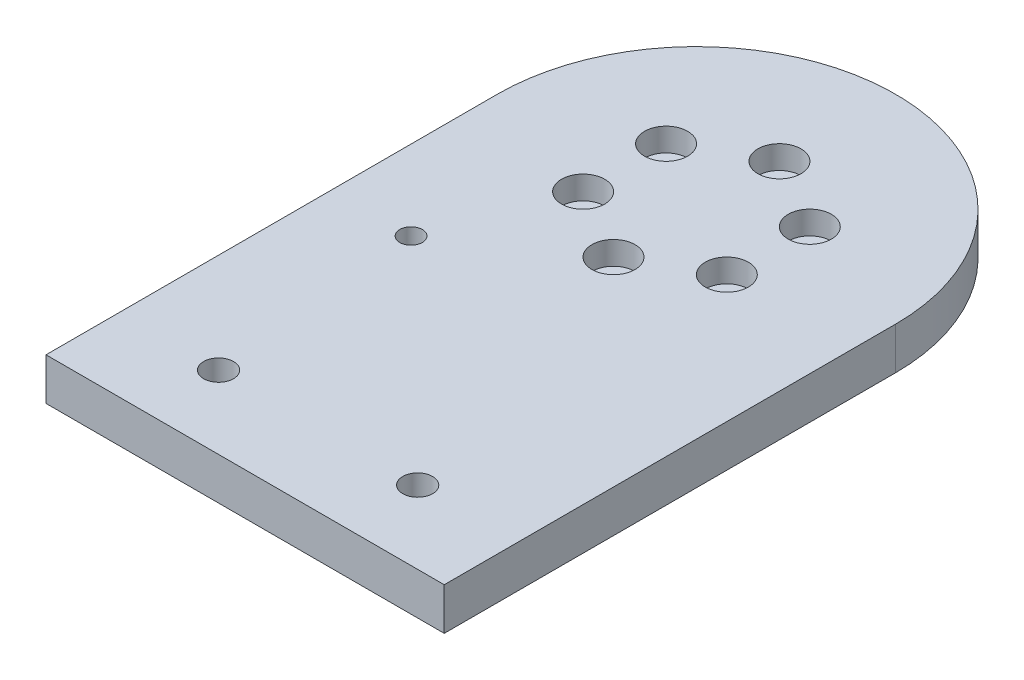
from build123d import *

# Parameters (mm, degrees)
PLACA_START               = 59.75
SK_PLACA_W                = 60
SK_PLACA_H                = 49
PLACA_DEPTH               = 6.35
EXTREMO_START             = 59.75
SK_EXTREMO_R              = 30
EXTREMO_DEPTH             = 6.35
PASANTES_M3_CUBO_J3_START = 59.75
SK_PASANTES_M3_CUBO_J3_R  = 1.7
PASANTES_M3_CUBO_J3_DEPTH = 6.35
CAJAS_M3_J3_START         = 62.6
SK_CAJAS_M3_J3_R          = 3.25
CAJAS_M3_J3_DEPTH         = 3.5
EXTENSION_PESTANAS_START  = 59.75
SK_EXTENSION_PESTANAS_W   = 60
SK_EXTENSION_PESTANAS_H   = 19
EXTENSION_PESTANAS_DEPTH  = 6.35
PASANTES_M4_REPISA_START  = 59.75
SK_PASANTES_M4_REPISA_R   = 2.25
PASANTES_M4_REPISA_DEPTH  = 6.35
PASANTE_M3_CINCHO_START   = 59.75
SK_PASANTE_M3_CINCHO_R    = 1.7
PASANTE_M3_CINCHO_DEPTH   = 6.35


with BuildPart() as part:
    # Sk_Placa → Placa (new body)
    with BuildSketch(Plane(origin=(0, 0, 0), x_dir=(1, 0, 0), z_dir=(0, 1, 0)).offset(PLACA_START)):
        with Locations((0, -354.5)):
            Rectangle(SK_PLACA_W, SK_PLACA_H)
    extrude(amount=PLACA_DEPTH)

    # Sk_Extremo → Extremo (add)
    with BuildSketch(Plane(origin=(0, 0, 0), x_dir=(1, 0, 0), z_dir=(0, 1, 0)).offset(EXTREMO_START)):
        with Locations((0, -330)):
            Circle(SK_EXTREMO_R)
    extrude(amount=EXTREMO_DEPTH)

    # Sk_Pasantes_M3_cubo_J3 → Pasantes_M3_cubo_J3 (cut)
    with BuildSketch(Plane(origin=(0, 0, 0), x_dir=(1, 0, 0), z_dir=(0, 1, 0)).offset(PASANTES_M3_CUBO_J3_START)):
        with Locations(Location((10.825317547, -336.25, 0), (0, 0, 270))):
            Circle(SK_PASANTES_M3_CUBO_J3_R)
        with Locations(Location((0, -342.5, 0), (0, 0, 270))):
            Circle(SK_PASANTES_M3_CUBO_J3_R)
        with Locations(Location((-10.825317547, -336.25, 0), (0, 0, 270))):
            Circle(SK_PASANTES_M3_CUBO_J3_R)
        with Locations(Location((-10.825317547, -323.75, 0), (0, 0, 270))):
            Circle(SK_PASANTES_M3_CUBO_J3_R)
        with Locations(Location((0, -317.5, 0), (0, 0, 270))):
            Circle(SK_PASANTES_M3_CUBO_J3_R)
        with Locations(Location((10.825317547, -323.75, 0), (0, 0, 270))):
            Circle(SK_PASANTES_M3_CUBO_J3_R)
    extrude(amount=PASANTES_M3_CUBO_J3_DEPTH, mode=Mode.SUBTRACT)

    # Sk_Cajas_M3_J3 → Cajas_M3_J3 (cut)
    with BuildSketch(Plane(origin=(0, 0, 0), x_dir=(1, 0, 0), z_dir=(0, 1, 0)).offset(CAJAS_M3_J3_START)):
        with Locations(Location((10.825317547, -336.25, 0), (0, 0, 270))):
            Circle(SK_CAJAS_M3_J3_R)
        with Locations(Location((0, -342.5, 0), (0, 0, 270))):
            Circle(SK_CAJAS_M3_J3_R)
        with Locations(Location((-10.825317547, -336.25, 0), (0, 0, 270))):
            Circle(SK_CAJAS_M3_J3_R)
        with Locations(Location((-10.825317547, -323.75, 0), (0, 0, 270))):
            Circle(SK_CAJAS_M3_J3_R)
        with Locations(Location((0, -317.5, 0), (0, 0, 270))):
            Circle(SK_CAJAS_M3_J3_R)
        with Locations(Location((10.825317547, -323.75, 0), (0, 0, 270))):
            Circle(SK_CAJAS_M3_J3_R)
    extrude(amount=CAJAS_M3_J3_DEPTH, mode=Mode.SUBTRACT)

    # Sk_Extension_pestanas → Extension_pestanas (add)
    with BuildSketch(Plane(origin=(0, 0, 0), x_dir=(1, 0, 0), z_dir=(0, 1, 0)).offset(EXTENSION_PESTANAS_START)):
        with Locations((0, -388.5)):
            Rectangle(SK_EXTENSION_PESTANAS_W, SK_EXTENSION_PESTANAS_H)
    extrude(amount=EXTENSION_PESTANAS_DEPTH)

    # Sk_Pasantes_M4_repisa → Pasantes_M4_repisa (cut)
    with BuildSketch(Plane(origin=(0, 0, 0), x_dir=(1, 0, 0), z_dir=(0, 1, 0)).offset(PASANTES_M4_REPISA_START)):
        with Locations(Location((-15, -387, 0), (0, 0, 270))):
            Circle(SK_PASANTES_M4_REPISA_R)
        with Locations(Location((15, -387, 0), (0, 0, 270))):
            Circle(SK_PASANTES_M4_REPISA_R)
    extrude(amount=PASANTES_M4_REPISA_DEPTH, mode=Mode.SUBTRACT)

    # Sk_Pasante_M3_cincho → Pasante_M3_cincho (cut)
    with BuildSketch(Plane(origin=(0, 0, 0), x_dir=(1, 0, 0), z_dir=(0, 1, 0)).offset(PASANTE_M3_CINCHO_START)):
        with Locations(Location((-18, -355, 0), (0, 0, 270))):
            Circle(SK_PASANTE_M3_CINCHO_R)
    extrude(amount=PASANTE_M3_CINCHO_DEPTH, mode=Mode.SUBTRACT)


solid = part.part
